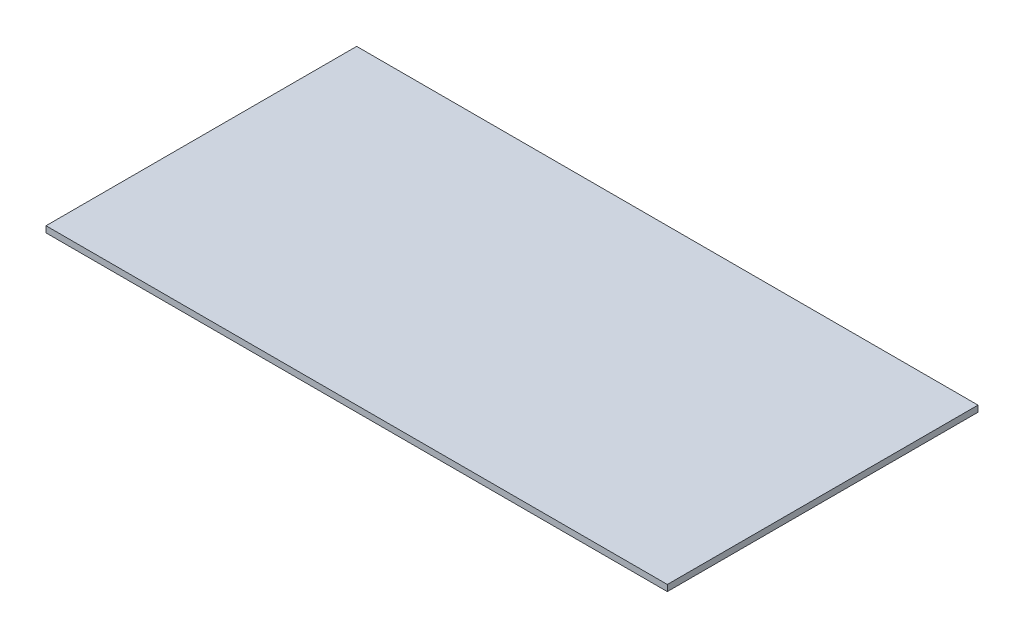
from build123d import *

# Parameters (mm, degrees)
SKETCH1_W           = 317.5
SKETCH1_H           = 158.75
BOSS_EXTRUDE1_DEPTH = 3.175


with BuildPart() as part:
    # Sketch1 → Boss-Extrude1 (new body)
    with BuildSketch(Plane(origin=(0, 0, 0), x_dir=(1, 0, 0), z_dir=(0, 1, 0))):
        Rectangle(SKETCH1_W, SKETCH1_H)
    extrude(amount=BOSS_EXTRUDE1_DEPTH)


solid = part.part
